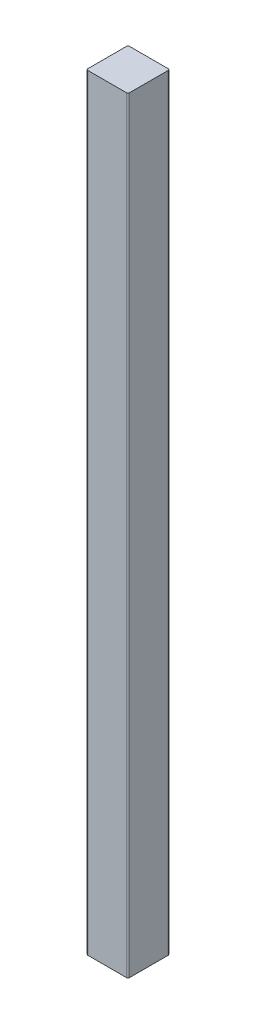
from build123d import *

# Parameters (mm, degrees)
SKETCH1_W           = 88.9
SKETCH1_H           = 88.9
BOSS_EXTRUDE1_DEPTH = 1635.125
FILLET1_R           = 3.175


with BuildPart() as part:
    # Sketch1 → Boss-Extrude1 (new body)
    with BuildSketch(Plane(origin=(0, 0, 0), x_dir=(1, 0, 0), z_dir=(0, 1, 0))):
        Rectangle(SKETCH1_W, SKETCH1_H)
    extrude(amount=BOSS_EXTRUDE1_DEPTH)

    # Fillet1
    fillet1_edges = [part.edges().sort_by_distance(p)[0] for p in [
        (44.45, 817.5625, 44.45),
        (-44.45, 817.5625, 44.45),
        (-44.45, 817.5625, -44.45),
        (44.45, 817.5625, -44.45),
    ]]
    fillet(fillet1_edges, radius=FILLET1_R)


solid = part.part
